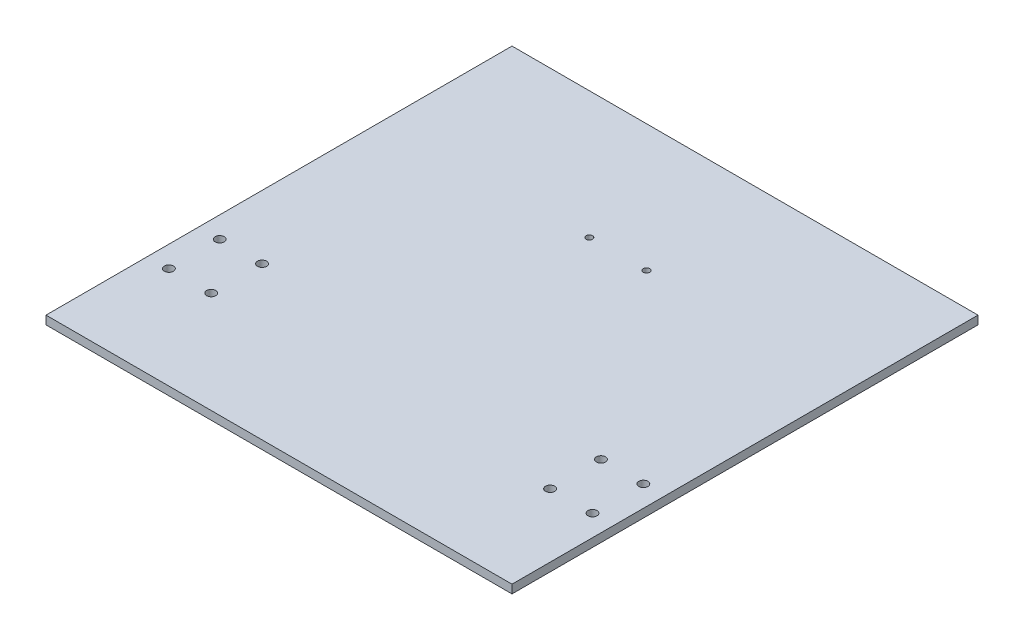
from build123d import *

# Parameters (mm, degrees)
SKETCH2_W           = 220
SKETCH2_H           = 220
SKETCH2_R           = 1.5
SKETCH2_R_2         = 2.15
BOSS_EXTRUDE1_DEPTH = 4


with BuildPart() as part:
    # Sketch2 → Boss-Extrude1 (new body)
    with BuildSketch(Plane(origin=(0, 0, 0), x_dir=(1, 0, 0), z_dir=(0, 1, 0))):
        Rectangle(SKETCH2_W, SKETCH2_H)
        with Locations((-13.5, 50)):
            Circle(SKETCH2_R, mode=Mode.SUBTRACT)
        with Locations((-100, -38)):
            Circle(SKETCH2_R_2, mode=Mode.SUBTRACT)
        with Locations((-80, -38)):
            Circle(SKETCH2_R_2, mode=Mode.SUBTRACT)
        with Locations((-80, -62)):
            Circle(SKETCH2_R_2, mode=Mode.SUBTRACT)
        with Locations((-100, -62)):
            Circle(SKETCH2_R_2, mode=Mode.SUBTRACT)
        with Locations((100, -62)):
            Circle(SKETCH2_R_2, mode=Mode.SUBTRACT)
        with Locations((80, -62)):
            Circle(SKETCH2_R_2, mode=Mode.SUBTRACT)
        with Locations((80, -38)):
            Circle(SKETCH2_R_2, mode=Mode.SUBTRACT)
        with Locations((100, -38)):
            Circle(SKETCH2_R_2, mode=Mode.SUBTRACT)
        with Locations((13.5, 50)):
            Circle(SKETCH2_R, mode=Mode.SUBTRACT)
    extrude(amount=BOSS_EXTRUDE1_DEPTH)


solid = part.part
